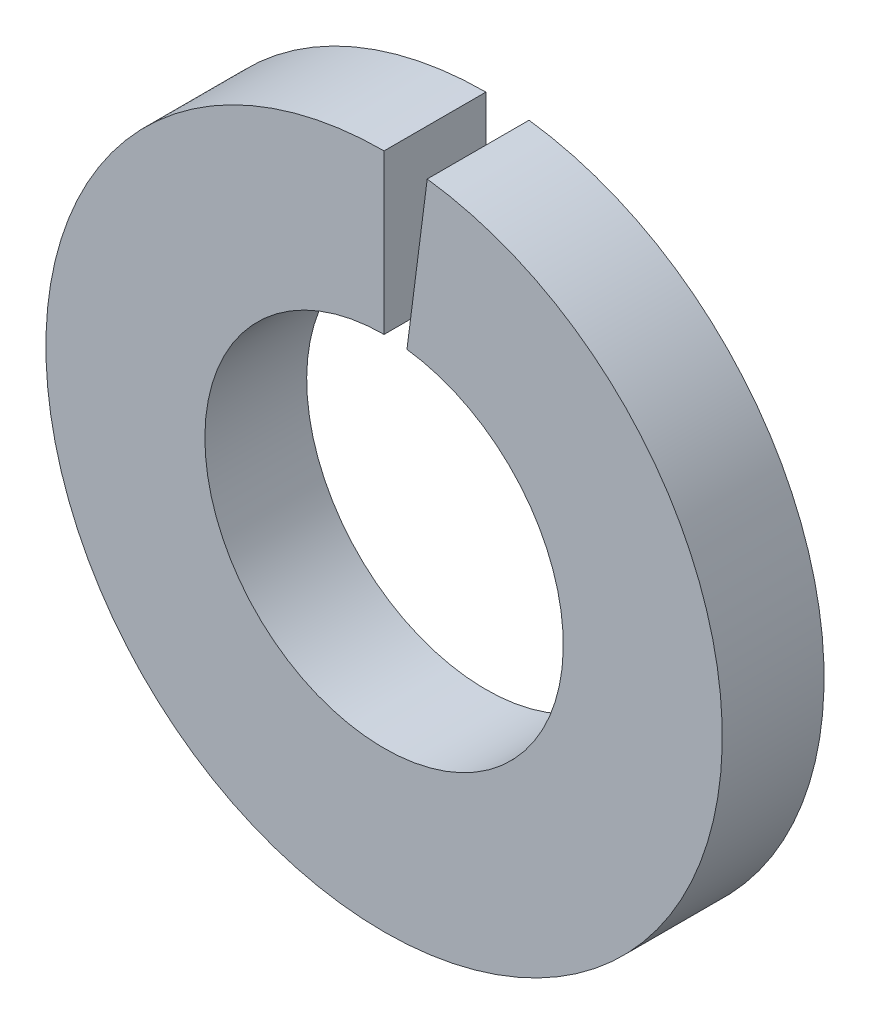
from build123d import *

# Parameters (mm, degrees)
SKETCH1_R      = 6.1595
SKETCH1_R_2    = 3.2639
EXTRUDE1_DEPTH = 1.8542
EXTRUDE2_START = -1.8542
EXTRUDE2_DEPTH = 1.8542


with BuildPart() as part:
    # Sketch1 → Extrude1 (new body)
    with BuildSketch(Plane.XY):
        Circle(SKETCH1_R)
        Circle(SKETCH1_R_2, mode=Mode.SUBTRACT)
    extrude(amount=EXTRUDE1_DEPTH)

    # Sketch2 → Extrude2 (cut)
    with BuildSketch(Plane.XY.offset(1.8542).offset(EXTRUDE2_START)):
        with BuildLine():
            Line((0, 0), (0, 6.1595))
            ThreePointArc((0, 6.1595), (0.393778969, 6.146899899), (0.785946881, 6.109151148))
            Line((0.785946881, 6.109151148), (0, 0))
        make_face()
    extrude(amount=EXTRUDE2_DEPTH, mode=Mode.SUBTRACT)


solid = part.part
